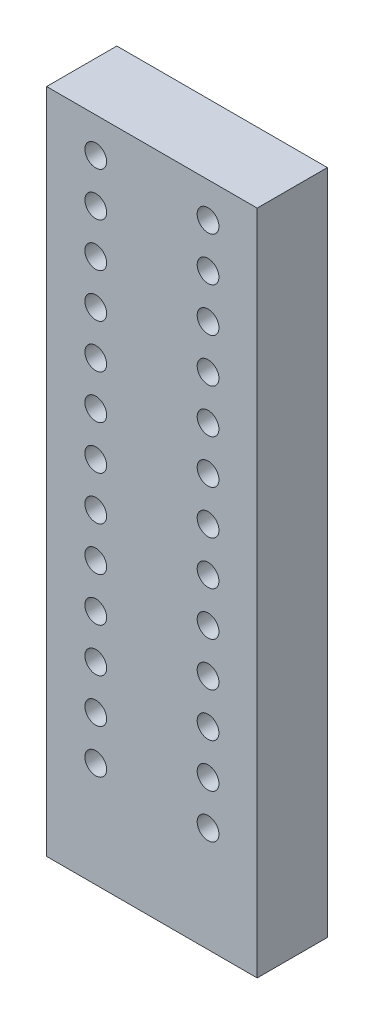
from build123d import *

# Parameters (mm, degrees)
ESQUISSE1_W                                   = 60
ESQUISSE1_H                                   = 190
BOSS_EXTRU_1_DEPTH                            = 20
TROU_POUR_TARAUDAGE_POUR_TROU_TARAUD_M6_D     = 5
TROU_POUR_TARAUDAGE_POUR_TROU_TARAUD_M6_DEPTH = 15
TROU_POUR_TARAUDAGE_POUR_TROU_TARAUD_M6_TIP   = 1.502151548
D_GAGEMENT_M61_D                              = 6.2
R_P_TITION_LIN_AIRE1_COUNT                    = 13
R_P_TITION_LIN_AIRE1_PITCH                    = 12.5


with BuildPart() as part:
    # Esquisse1 → Boss.-Extru.1 (new body)
    with BuildSketch(Plane.XY):
        Rectangle(ESQUISSE1_W, ESQUISSE1_H)
    extrude(amount=BOSS_EXTRU_1_DEPTH)

    # Trou pour taraudage pour trou taraudé M61
    with Locations(Plane(origin=(0, -95, 0), x_dir=(-1, 0, 0), z_dir=(0, -1, 0))):
        with Locations((-20, -10), (20, -10)):
            Hole(TROU_POUR_TARAUDAGE_POUR_TROU_TARAUD_M6_D / 2, depth=TROU_POUR_TARAUDAGE_POUR_TROU_TARAUD_M6_DEPTH)
            with Locations((0, 0, -(TROU_POUR_TARAUDAGE_POUR_TROU_TARAUD_M6_DEPTH + TROU_POUR_TARAUDAGE_POUR_TROU_TARAUD_M6_TIP / 2))):  # 118° drill point
                Cone(0, TROU_POUR_TARAUDAGE_POUR_TROU_TARAUD_M6_D / 2, TROU_POUR_TARAUDAGE_POUR_TROU_TARAUD_M6_TIP, mode=Mode.SUBTRACT)

    # Dégagement M61 (through all)
    with Locations(Plane.XY.offset(20)):
        with Locations((-16, -65), (16, -65)):
            d_gagement_m61 = Hole(D_GAGEMENT_M61_D / 2)

    # Répétition linéaire1: Dégagement M61 ×13
    with Locations(*[(0, i * R_P_TITION_LIN_AIRE1_PITCH, 0) for i in range(1, R_P_TITION_LIN_AIRE1_COUNT)]):
        add(d_gagement_m61, mode=Mode.SUBTRACT)


solid = part.part
